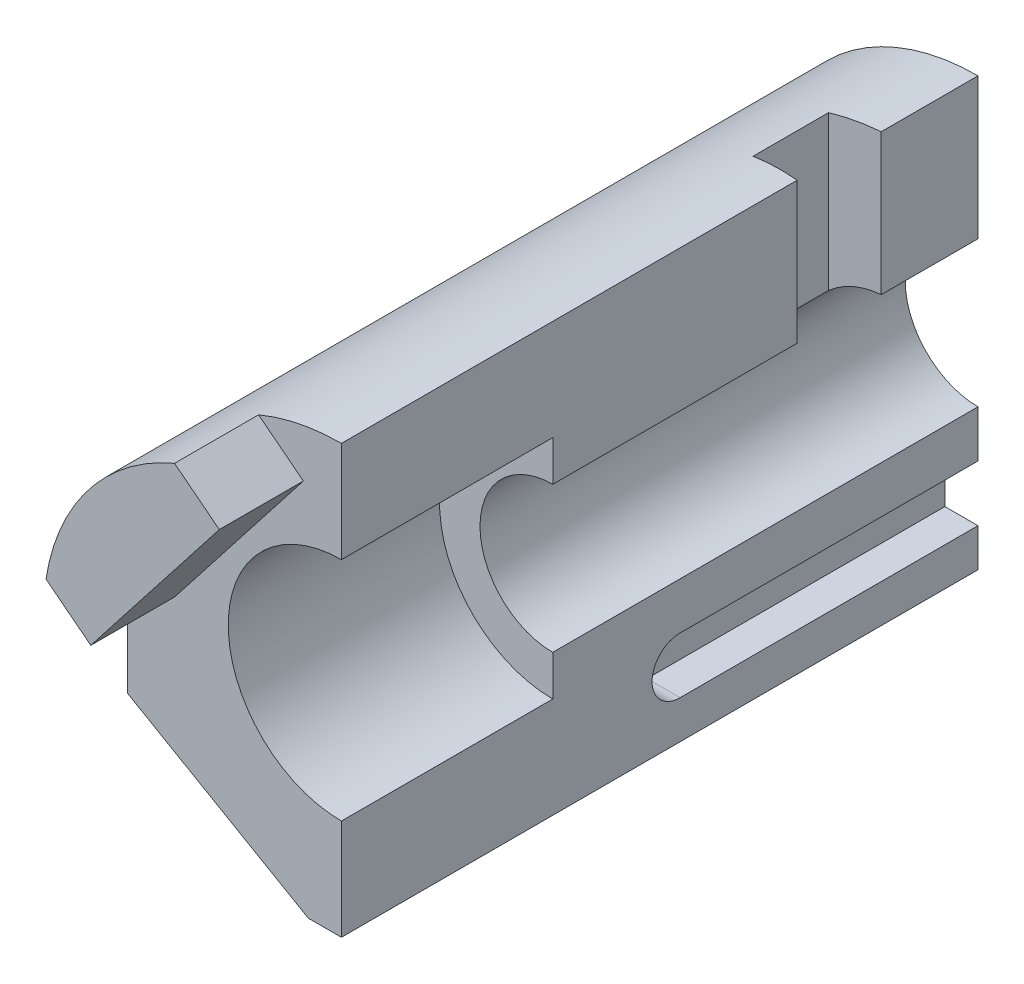
from build123d import *

# Parameters (mm, degrees)
BOSS_EXTRUDE1_DEPTH     = 250
BOSS_EXTRUDE2_START     = -167
BOSS_EXTRUDE2_DEPTH     = 167
CUT_EXTRUDE1_REACH      = 314.698
CUT_EXTRUDE1_END_RADIUS = 28.575
BOSS_EXTRUDE3_START     = 33
BOSS_EXTRUDE3_DEPTH     = 33
CUT_EXTRUDE2_DEPTH      = 13


with BuildPart() as part:
    # Sketch1 → Boss-Extrude1 (new body)
    with BuildSketch(Plane.XY):
        with BuildLine():
            Line((-84, 0), (-84, -43.008130888))
            Line((-84, -43.008130888), (-13, -84))
            Line((-13, -84), (0, -84))
            Line((0, -84), (0, -44.45))
            ThreePointArc((0, -44.45), (-44.45, 0), (0, 44.45))
            Line((0, 44.45), (0, 84))
            ThreePointArc((0, 84), (-59.39696962, 59.39696962), (-84, 0))
        make_face()
    extrude(amount=-BOSS_EXTRUDE1_DEPTH)

    # Sketch2 → Boss-Extrude2 (add)
    with BuildSketch(Plane(origin=(0, 0, -250), x_dir=(-1, 0, 0), z_dir=(0, 0, -1)).offset(BOSS_EXTRUDE2_START)):
        with BuildLine():
            Line((0, 28.575), (0, 44.45))
            ThreePointArc((0, 44.45), (44.45, 0), (0, -44.45))
            Line((0, -44.45), (0, -28.575))
            ThreePointArc((0, -28.575), (28.575, 0), (0, 28.575))
        make_face()
    extrude(amount=BOSS_EXTRUDE2_DEPTH)

    # Cut-Extrude1: up to this cylinder (the profile starts outside it)
    cut_extrude1_end = Plane(origin=(0, 0, -195.5), z_dir=(0, 0, -1)) * Cylinder(CUT_EXTRUDE1_END_RADIUS, 687.546, mode=Mode.PRIVATE)
    # Sketch3 → Cut-Extrude1 (cut, up to the surface)
    with BuildSketch(Plane(origin=(0, 84, 0), x_dir=(1, 0, 0), z_dir=(0, 1, 0)), mode=Mode.PRIVATE) as cut_extrude1_sk1:
        Polygon((0, 179), (0, 212), (-19, 210.337715393), (-19, 180.662284607), align=None)
    cut_extrude1_tool1 = extrude(cut_extrude1_sk1.sketch, amount=-CUT_EXTRUDE1_REACH, mode=Mode.PRIVATE) - cut_extrude1_end
    add(cut_extrude1_tool1.solids().sort_by_distance((-9.332027, 84, -195.5))[0], mode=Mode.SUBTRACT)

    # Sketch4 → Boss-Extrude3 (add)
    with BuildSketch(Plane.XY.offset(BOSS_EXTRUDE3_START)):
        with BuildLine():
            Line((-83.014649379, 12.828405531), (-65.430668922, -0.909705656))
            Line((-65.430668922, -0.909705656), (-14.946427946, 63.707176139))
            Line((-14.946427946, 63.707176139), (-32.530408402, 77.445287327))
            ThreePointArc((-32.530408402, 77.445287327), (-66.192903303, 51.715563927), (-83.014649379, 12.828405531))
        make_face()
    extrude(amount=-BOSS_EXTRUDE3_DEPTH)

    # Sketch5 → Cut-Extrude2 (cut)
    with BuildSketch(Plane(origin=(0, 0, 0), x_dir=(0, 0, -1), z_dir=(1, 0, 0))):
        with BuildLine():
            Line((250, -69), (133, -69))
            ThreePointArc((133, -69), (122, -58), (133, -47))
            Line((133, -47), (250, -47))
            ThreePointArc((250, -47), (261, -58), (250, -69))
        make_face()
    extrude(amount=-CUT_EXTRUDE2_DEPTH, mode=Mode.SUBTRACT)


solid = part.part
